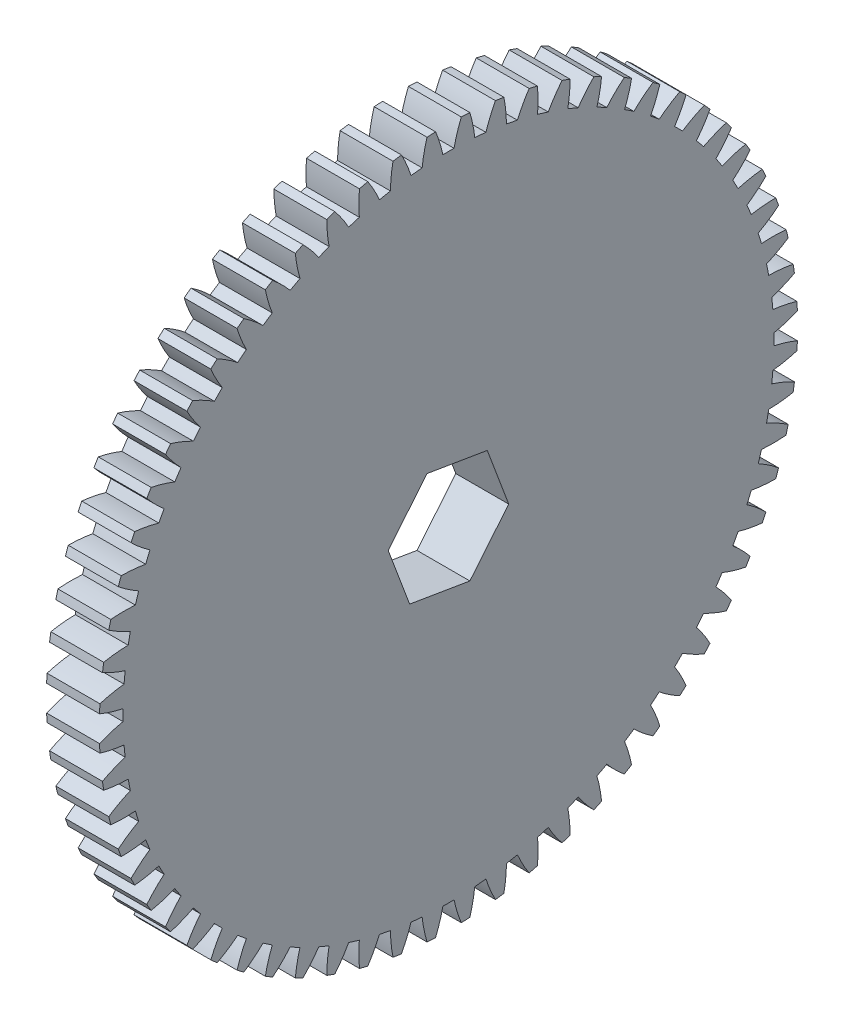
from build123d import *

# Parameters (mm, degrees)
BASPROSKE_W        = 6.35
BASPROSKE_H        = 41.91
TOOTHCUT_DEPTH     = 60.60888105
TEETHCUTS_COUNT    = 64
TEETHCUTS_ANGLE    = 354.375
HUBNEABOTSKE_R     = 1.27
HUBNEARBOTH_DEPTH  = 22.2250254
HUBFAR_START       = 22.2250254
HUBFARSKE_R        = 1.27
HUBFAR_DEPTH       = 22.2250254
BORSKE_R           = 6.35
BORE_DEPTH         = 50.8000508
CUT_EXTRUDE1_DEPTH = 60.568839232


with BuildPart() as part:
    # BasProSke → Base-Revolve (revolve)
    with BuildSketch(Plane(origin=(0, 0, 0), x_dir=(1, 0, 0), z_dir=(0, 1, 0)), mode=Mode.PRIVATE) as base_revolve_sk:
        with Locations((3.175, 20.955)):
            Rectangle(BASPROSKE_W, BASPROSKE_H)
    revolve(base_revolve_sk.sketch.rotate(Axis((-10, 0, 0), (1, 0, 0)), 180), axis=Axis((-10, 0, 0), (1, 0, 0)))

    # TooCutSke → ToothCut (cut, through all)
    with BuildSketch(Plane(origin=(0, 0, 0), x_dir=(0, 0, -1), z_dir=(1, 0, 0))):
        with BuildLine():
            ThreePointArc((0.671374175, 39.059430459), (0, 39.0652), (-0.671374175, 39.059430459))
            ThreePointArc((-0.671374175, 39.059430459), (-1.047799451, 40.503293436), (-1.555030324, 41.906558602))
            ThreePointArc((-1.555030324, 41.906558602), (0, 41.9354), (1.555030324, 41.906558602))
            ThreePointArc((1.555030324, 41.906558602), (1.047799451, 40.503293436), (0.671374175, 39.059430459))
        make_face()
    toothcut = extrude(amount=TOOTHCUT_DEPTH, mode=Mode.SUBTRACT)

    # TeethCuts: ToothCut ×64 about axis
    teethcuts_axis = Axis((-10, 0, 0), (1, 0, 0))
    for i in range(1, TEETHCUTS_COUNT):
        add(toothcut.rotate(teethcuts_axis, i * TEETHCUTS_ANGLE / (TEETHCUTS_COUNT - 1)), mode=Mode.SUBTRACT)

    # HubNeaBotSke → HubNearBoth (add)
    with BuildSketch(Plane.ZY):
        with Locations(Location((0, 0, 0), (0, 0, 180))):
            Circle(HUBNEABOTSKE_R)
    extrude(amount=HUBNEARBOTH_DEPTH)

    # HubFarSke → HubFar (add)
    with BuildSketch(Plane(origin=(6.35, 0, 0), x_dir=(0, 0, -1), z_dir=(1, 0, 0)).offset(HUBFAR_START)):
        Circle(HUBFARSKE_R)
    extrude(amount=-HUBFAR_DEPTH)

    # BorSke → Bore (cut, symmetric)
    with BuildSketch(Plane(origin=(0, 0, 0), x_dir=(0, 0, -1), z_dir=(1, 0, 0))):
        with Locations(Location((0, 0, 0), (0, 0, 180))):
            Circle(BORSKE_R)
    extrude(amount=BORE_DEPTH, both=True, mode=Mode.SUBTRACT)

    # Sketch1 → Cut-Extrude1 (cut, through all)
    with BuildSketch(Plane(origin=(6.35, 0, 0), x_dir=(0, 0, -1), z_dir=(1, 0, 0))):
        Polygon((4.66122707, 5.660061442), (-2.571143461, 6.866771777), (-7.232370531, 1.206710334), (-4.66122707, -5.660061442), (2.571143461, -6.866771777), (7.232370531, -1.206710334), align=None)
    extrude(amount=-CUT_EXTRUDE1_DEPTH, mode=Mode.SUBTRACT)


solid = part.part
